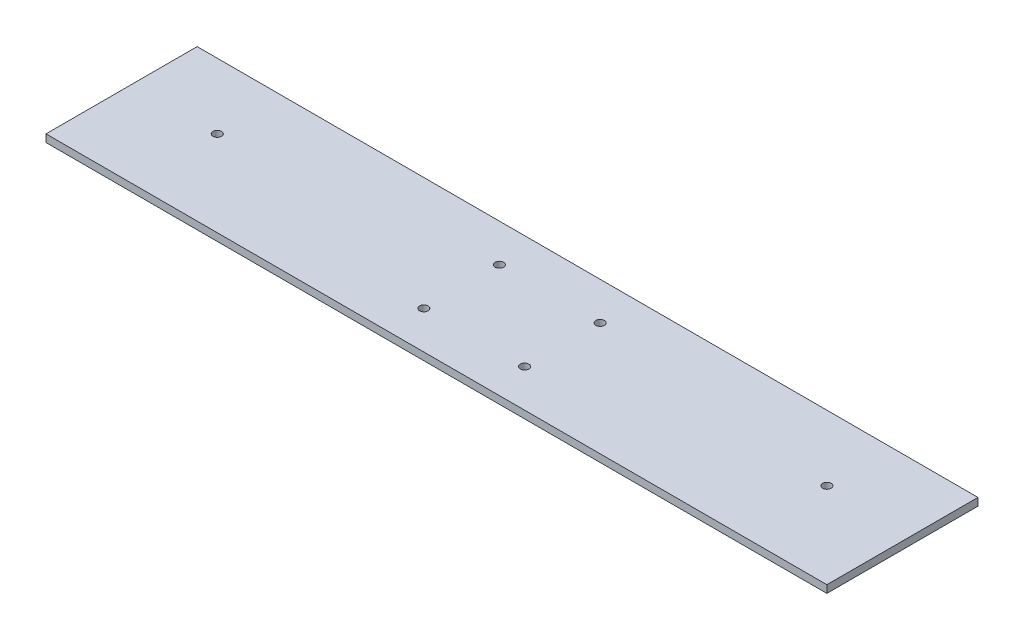
from build123d import *

# Parameters (mm, degrees)
SKETCH1_W           = 310
SKETCH1_H           = 60
BOSS_EXTRUDE1_DEPTH = 3
OTW_R_POD_RUB_M31_D = 3.4


with BuildPart() as part:
    # Sketch1 → Boss-Extrude1 (new body)
    with BuildSketch(Plane(origin=(0, 0, 0), x_dir=(1, 0, 0), z_dir=(0, 1, 0))):
        with Locations((145, 30)):
            Rectangle(SKETCH1_W, SKETCH1_H)
    extrude(amount=BOSS_EXTRUDE1_DEPTH)

    # Otwór pod śrubę M31 (through all)
    with Locations(Plane(origin=(0, 3, 0), x_dir=(1, 0, 0), z_dir=(0, 1, 0))):
        with Locations((266, 34), (24, 34), (125, 15), (165, 15), (165, 45), (125, 45)):
            Hole(OTW_R_POD_RUB_M31_D / 2)


solid = part.part
